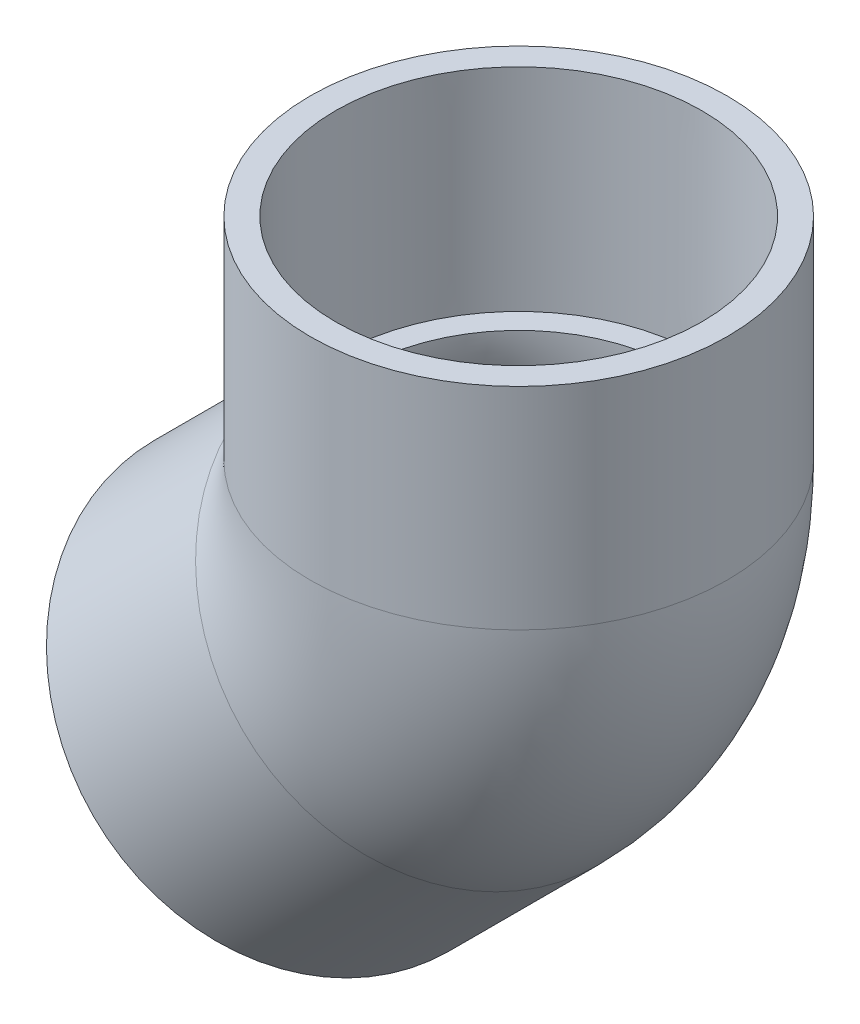
from build123d import *

# Parameters (mm, degrees)
SKETCH3_R   = 34.528125
SKETCH3_R_2 = 26.2509


with BuildPart() as part:
    # Sketch1 → Revolve1 (revolve)
    with BuildSketch(Plane.XY):
        Polygon((-11.505953155, -60.336095813), (13.189751178, -35.64039148), (10.048906599, -32.499546902), (-14.485153123, -57.356895845), align=None)
    revolve(axis=Axis((-35.921024484, -35.921024484, 0), (0.7071067811865486, 0.7071067811865465, 0)))



with BuildPart() as body_2:
    # Sketch2 → Revolve2 (revolve)
    with BuildSketch(Plane.XY, mode=Mode.PRIVATE) as revolve2_sk:
        Polygon((30.3149, 50.8), (30.0863, 15.875), (34.528125, 15.875), (34.528125, 50.8), align=None)
    revolve(revolve2_sk.sketch.rotate(Axis((0, 0, 0), (0, 1, 0)), 90), axis=Axis((0, 0, 0), (0, 1, 0)))


with BuildPart() as part_1:
    add(part.part)

    add(body_2.part)  # Sweep1 merges body 2
    # Sweep1: sweep along a path in Sketch4
    with BuildLine(Plane.XY) as sweep1_path:
        ThreePointArc((-11.225320151, -11.225320151), (-2.917365657, 1.208412421), (0, 15.875))
    # Sketch3 → Sweep1 (sweep)
    with BuildSketch(Plane(origin=(-11.225320151, -11.225320151, 0), x_dir=(0, 0, -1), z_dir=(0.7071067811865488, 0.7071067811865464, 0))):
        Circle(SKETCH3_R)
        Circle(SKETCH3_R_2, mode=Mode.SUBTRACT)
    sweep(path=sweep1_path.line)


solid = part_1.part
